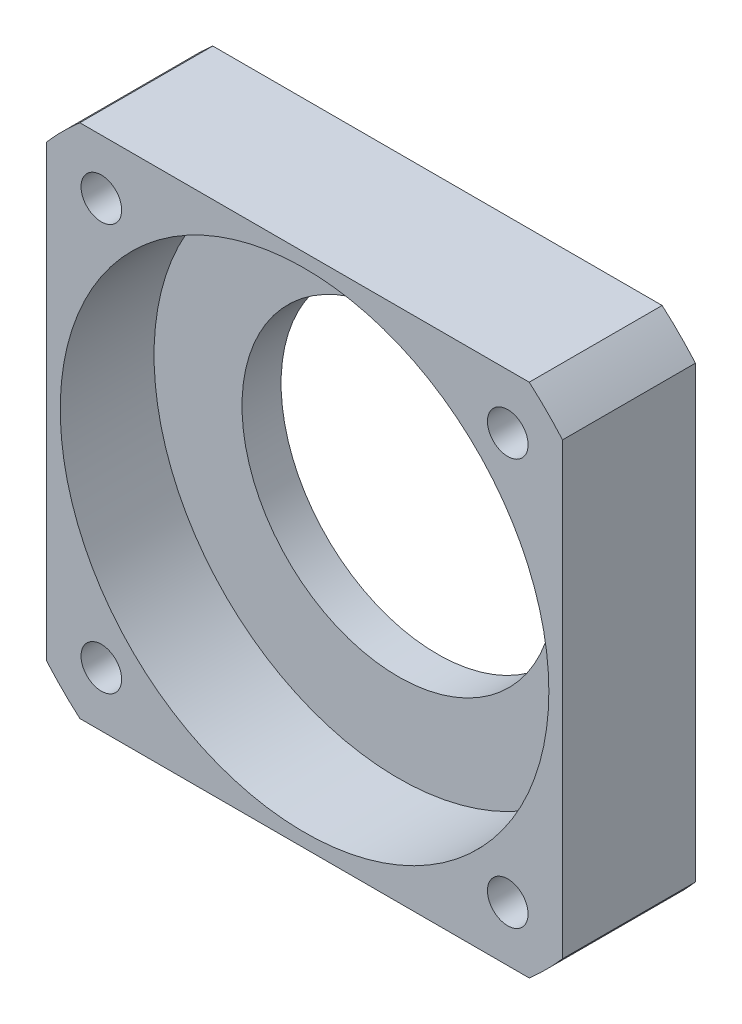
from build123d import *

# Parameters (mm, degrees)
SKETCH1_W           = 41.91
SKETCH1_H           = 41.91
SKETCH1_R           = 1.64973
SKETCH1_R_2         = 12.7
BOSS_EXTRUDE1_DEPTH = 10.795
SKETCH2_R           = 62.565718238
SKETCH2_R_2         = 27.7876
CUT_EXTRUDE1_DEPTH  = 61.244736077
SKETCH3_R           = 19.84375
CUT_EXTRUDE2_DEPTH  = 7.62


with BuildPart() as part:
    # Sketch1 → Boss-Extrude1 (new body)
    with BuildSketch(Plane.XY):
        with Locations((20.955, 20.955)):
            Rectangle(SKETCH1_W, SKETCH1_H)
        with Locations((37.460710751, 37.460710751)):
            Circle(SKETCH1_R, mode=Mode.SUBTRACT)
        with Locations((37.460710751, 4.449289249)):
            Circle(SKETCH1_R, mode=Mode.SUBTRACT)
        with Locations((4.449289249, 4.449289249)):
            Circle(SKETCH1_R, mode=Mode.SUBTRACT)
        with Locations((4.449289249, 37.460710751)):
            Circle(SKETCH1_R, mode=Mode.SUBTRACT)
        with Locations((20.955, 20.955)):
            Circle(SKETCH1_R_2, mode=Mode.SUBTRACT)
    extrude(amount=BOSS_EXTRUDE1_DEPTH)

    # Sketch2 → Cut-Extrude1 (cut, through all)
    with BuildSketch(Plane.XY.offset(10.795)):
        with Locations((20.955, 20.955)):
            Circle(SKETCH2_R)
        with Locations((20.955, 20.955)):
            Circle(SKETCH2_R_2, mode=Mode.SUBTRACT)
    extrude(amount=-CUT_EXTRUDE1_DEPTH, mode=Mode.SUBTRACT)

    # Sketch3 → Cut-Extrude2 (cut)
    with BuildSketch(Plane.XY.offset(10.795)):
        with Locations((20.955, 20.955)):
            Circle(SKETCH3_R)
    extrude(amount=-CUT_EXTRUDE2_DEPTH, mode=Mode.SUBTRACT)


solid = part.part
